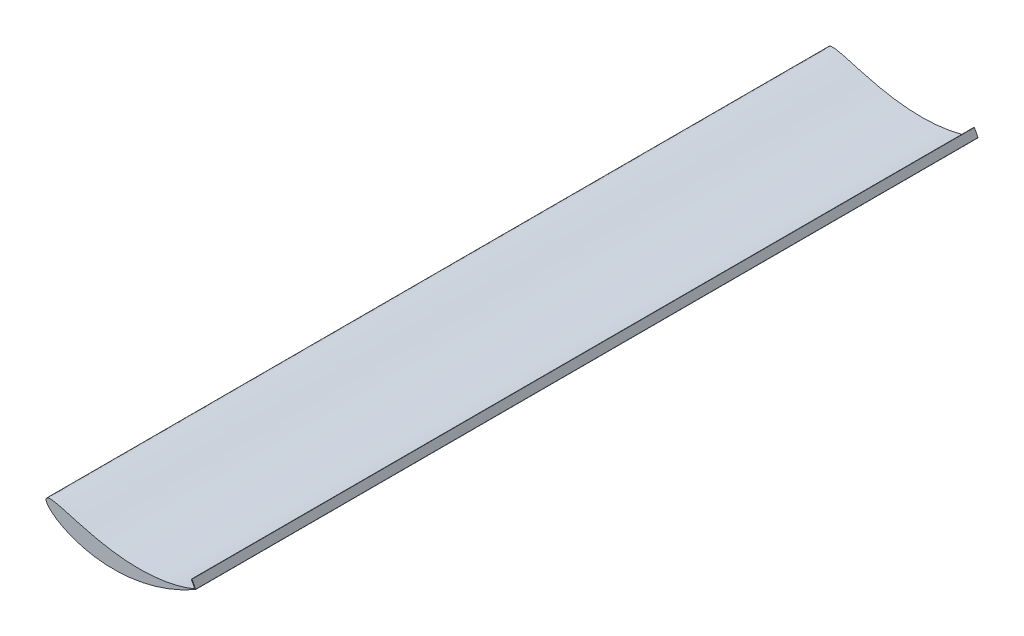
from build123d import *

# Parameters (mm, degrees)
BOSS_EXTRUDE2_DEPTH = 500


with BuildPart() as part:
    # Sketch2 → Boss-Extrude2 (new, symmetric)
    with BuildSketch(Plane.XY):
        with BuildLine():
            Line((191.120009683, -4.277332032), (186.601013041, 4.643355685))
            Line((186.601013041, 4.643355685), (185.708944269, 4.191456021))
            Line((185.708944269, 4.191456021), (190.040066052, -4.358358894))
            add(Edge.make_bspline(
                [(190.956241573, -4.77736524), (190.824351331, -4.850734656), (189.266236247, -5.716311549), (186.010858372, -7.493605265), (180.823647875, -10.214726931), (174.698235284, -13.256014318), (167.591359089, -16.539576282), (159.488349753, -19.954727654), (150.393963735, -23.365050943), (140.348546413, -26.612897793), (129.433550223, -29.52489825), (117.779572077, -31.923999878), (105.569465286, -33.64831355), (93.034005945, -34.56356047), (80.442649214, -34.585096665), (68.085686643, -33.687001479), (56.253297272, -31.909938952), (45.212267629, -29.357821392), (35.18655018, -26.186468616), (26.343549194, -22.585403233), (18.78766504, -18.759301824), (12.563296716, -14.906936471), (7.660206756, -11.205284673), (4.027604275, -7.803248784), (1.573653009, -4.796291384), (0.201464862, -2.252662899), (-0.213471604, -0.06899), (0.597068393, 1.674977484), (2.357212283, 2.58171888), (4.672962002, 2.919107572), (7.602116552, 2.830896678), (11.099165509, 2.353125626), (15.123144461, 1.538988042), (19.622681089, 0.440148356), (24.551910828, -0.886957346), (29.867907995, -2.386313545), (35.530801273, -4.003952145), (41.503381118, -5.68788873), (47.750244483, -7.389081418), (54.236719888, -9.063934352), (60.929227826, -10.671331854), (67.794322796, -12.175446037), (74.798612286, -13.544692531), (81.90874001, -14.751698968), (89.090951137, -15.774699654), (96.311448395, -16.595032008), (103.53616289, -17.199829314), (110.730986166, -17.58016163), (117.861845412, -17.731640773), (124.89487431, -17.654325895), (131.796397968, -17.352320574), (138.533291685, -16.834340768), (145.072823387, -16.112929151), (151.383194893, -15.204858341), (157.433178918, -14.129977131), (163.192716512, -12.912383637), (168.632500235, -11.579479452), (173.724620383, -10.162372786), (178.441318245, -8.693644841), (182.756848014, -7.210463104), (186.582564299, -5.774718274), (188.958215485, -4.812220312), (190.040066052, -4.358358894)],
                knots=[0.024527699, 0.024527699, 0.024527699, 0.024527699, 0.025589209, 0.037067816, 0.050854502, 0.066985023, 0.085457836, 0.106225288, 0.129179984, 0.15414868, 0.180883335, 0.209058052, 0.238271881, 0.268058238, 0.297903876, 0.327269841, 0.355623842, 0.382465397, 0.407355501, 0.429934859, 0.449938972, 0.46720151, 0.481654744, 0.493326476, 0.502345384, 0.508967218, 0.513683959, 0.517466281, 0.521650737, 0.527066359, 0.533951819, 0.542299609, 0.552017631, 0.562981801, 0.575062675, 0.588129088, 0.602056582, 0.616727009, 0.632028814, 0.64785818, 0.664118458, 0.680718254, 0.697573164, 0.714603084, 0.731732438, 0.748889669, 0.766005495, 0.783014285, 0.799851871, 0.816455186, 0.832763309, 0.848714238, 0.864246917, 0.879299022, 0.893808281, 0.907709696, 0.920937867, 0.933423618, 0.945096562, 0.955881369, 0.965700785, 0.974004748, 0.974004748, 0.974004748, 0.974004748], degree=3))
            ThreePointArc((190.956241573, -4.77736524), (191.141685896, -4.561266122), (191.120009683, -4.277332032))
        make_face()
    extrude(amount=BOSS_EXTRUDE2_DEPTH, both=True)


solid = part.part
